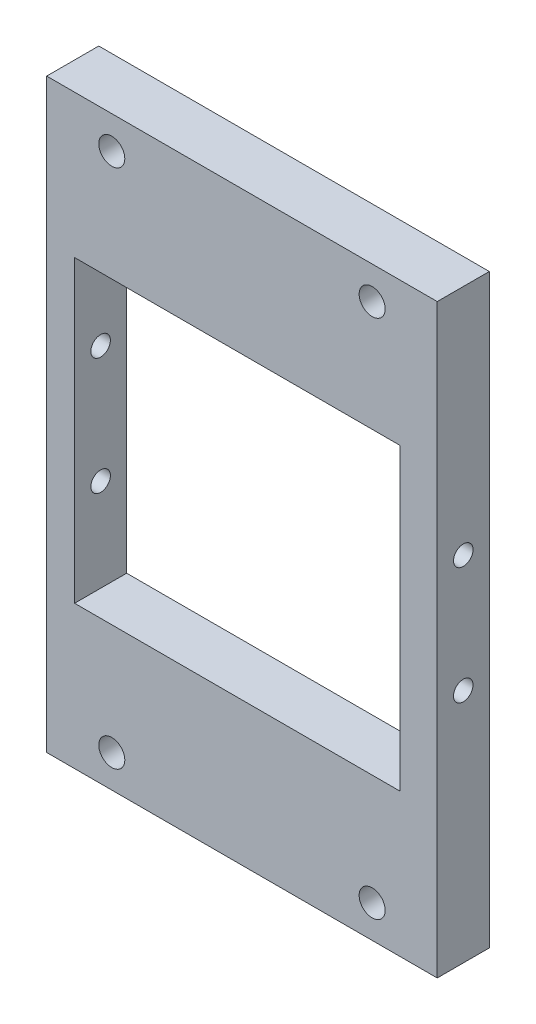
from build123d import *

# Parameters (mm, degrees)
SKETCH_1_W          = 60
SKETCH_1_H          = 90
EXTRUDE_1_DEPTH     = 8
CUT_EXTRUDE_1_REACH = 98.762
SKETCH_3_R          = 2
CUT_EXTRUDE_2_DEPTH = 97.762010118
SKETCH_4_R          = 1.5
CUT_EXTRUDE_3_DEPTH = 76.425459893


with BuildPart() as part:
    # 草图1 → 凸台-拉伸1 (new body)
    with BuildSketch(Plane.XY):
        with Locations((-55.287083442, 0)):
            Rectangle(SKETCH_1_W, SKETCH_1_H)
    extrude(amount=EXTRUDE_1_DEPTH)

    # 草图2 → 切除-拉伸1 (cut, up to next)
    with BuildSketch(Plane.XY.offset(8), mode=Mode.PRIVATE) as cut_extrude_1_sk1:
        Polygon((-81, 17), (-81, 23), (-31, 23), (-31, 17), (-31, -17), (-31, -23), (-81, -23), (-81, -17), align=None)
    cut_extrude_1_tool1 = extrude(cut_extrude_1_sk1.sketch, amount=-CUT_EXTRUDE_1_REACH, mode=Mode.PRIVATE) & part.part
    add(cut_extrude_1_tool1.solids().sort_by_distance((-56, 0, 8))[0], mode=Mode.SUBTRACT)

    # 草图3 → 切除-拉伸2 (cut, through all)
    with BuildSketch(Plane.XY.offset(8)):
        with Locations((-75.287083442, -40)):
            Circle(SKETCH_3_R)
        with Locations((-35.287083442, -40)):
            Circle(SKETCH_3_R)
    cut_extrude_2 = extrude(amount=-CUT_EXTRUDE_2_DEPTH, mode=Mode.SUBTRACT)

    # 镜向1: 切除-拉伸2 across plane
    add(cut_extrude_2.mirror(Plane.ZX), mode=Mode.SUBTRACT)

    # 草图4 → 切除-拉伸3 (cut, through all)
    with BuildSketch(Plane.ZY.offset(85.287083442)):
        with Locations((4, -8.747446088)):
            Circle(SKETCH_4_R)
        with Locations((4, 9.252553912)):
            Circle(SKETCH_4_R)
    extrude(amount=-CUT_EXTRUDE_3_DEPTH, mode=Mode.SUBTRACT)


solid = part.part
